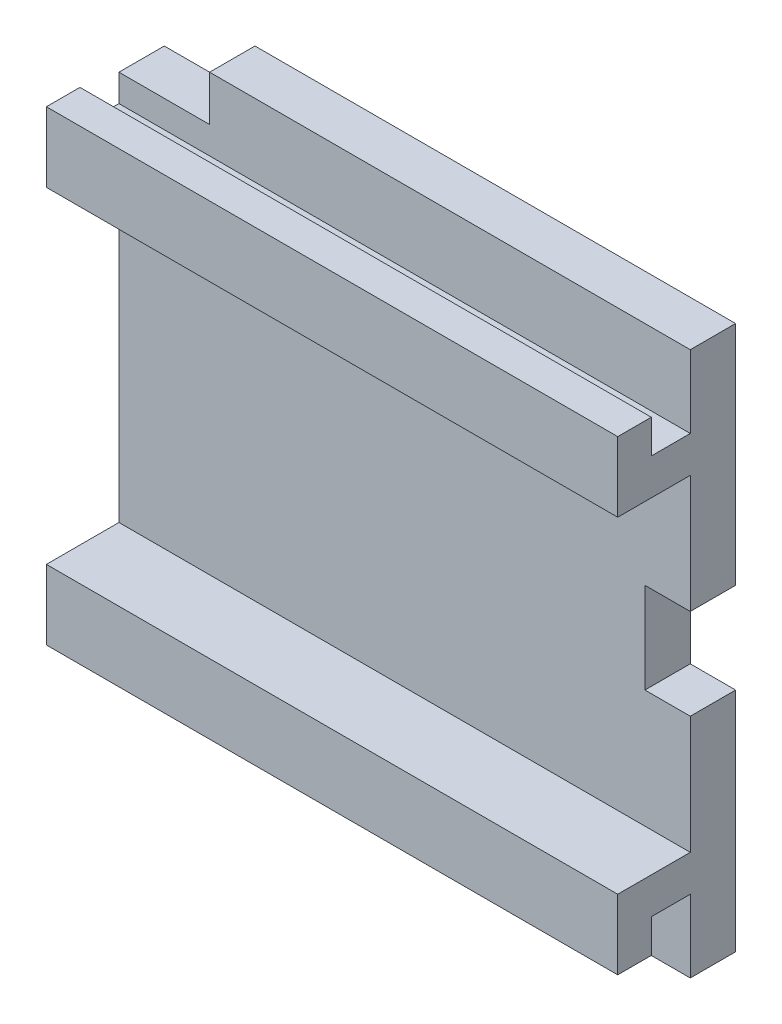
from build123d import *

# Parameters (mm, degrees)
BOSS_EXTRU_1_DEPTH      = 5
ESQUISSE5_R             = 1.5
ENL_V_MAT_EXTRU_1_DEPTH = 15
BOSS_EXTRU_2_DEPTH      = 63


with BuildPart() as part:
    # Esquisse1 → Boss.-Extru.1 (new body)
    with BuildSketch(Plane.XY):
        Polygon((63, 35), (58, 35), (58, 25), (63, 25), (63, 0), (53, 0), (53, 5), (10, 5), (10, 0), (0, 0), (0, 55), (10, 55), (10, 60), (63, 60), align=None)
    extrude(amount=BOSS_EXTRU_1_DEPTH)

    # Esquisse5 → Enlèv. mat.-Extru.1 (cut)
    with BuildSketch(Plane.ZY):
        with Locations((2.5, 2.5)):
            Circle(ESQUISSE5_R)
        with Locations((2.5, 57.5)):
            Circle(ESQUISSE5_R)
    extrude(amount=-ENL_V_MAT_EXTRU_1_DEPTH, mode=Mode.SUBTRACT)

    # Esquisse8 → Boss.-Extru.2 (add)
    with BuildSketch(Plane(origin=(63, 0, 0), x_dir=(0, 0, -1), z_dir=(1, 0, 0))):
        Polygon((-5, 52), (-9.3, 52), (-9.3, 55.7), (-13, 55.7), (-13, 48), (-5, 48), align=None)
        Polygon((-5, 12), (-5, 8), (-9.3, 8), (-9.3, 4.3), (-13, 4.3), (-13, 12), align=None)
    extrude(amount=-BOSS_EXTRU_2_DEPTH)


solid = part.part
